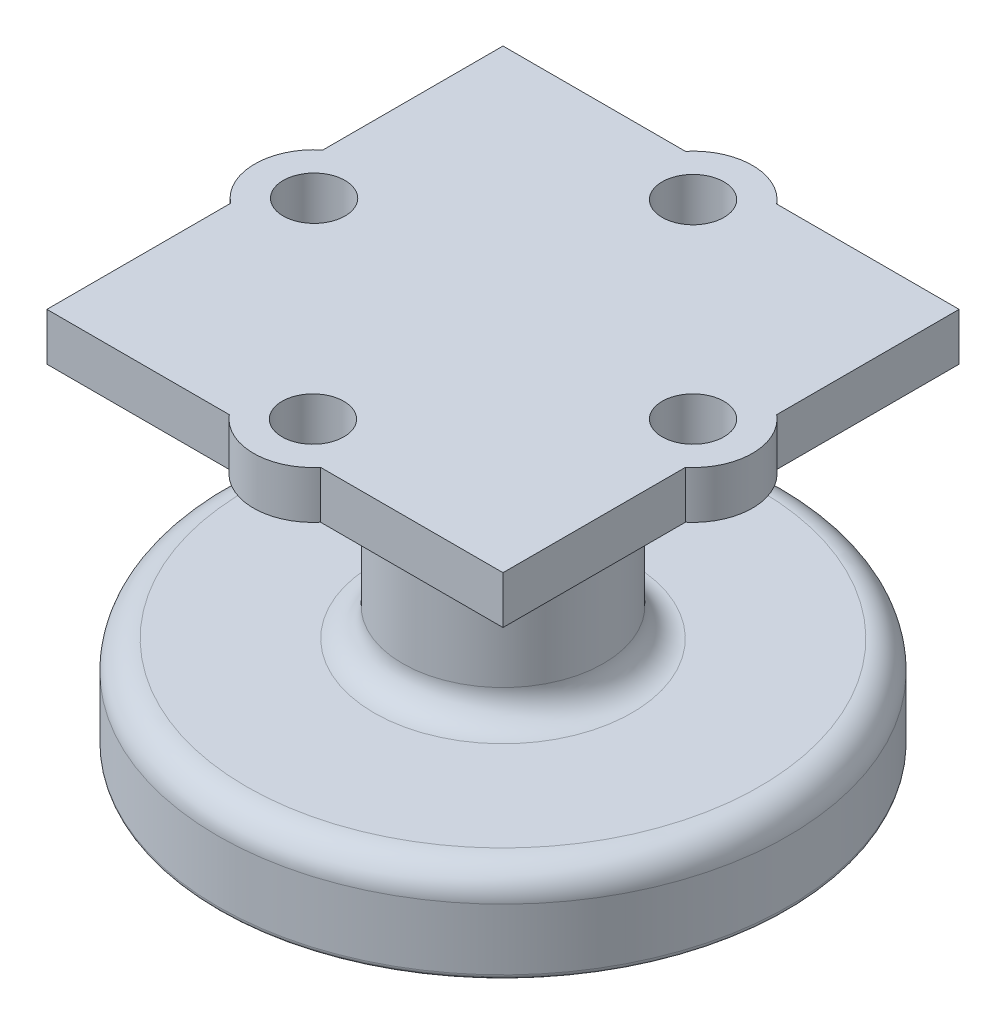
from build123d import *

# Parameters (mm, degrees)
SKETCH1_R           = 3.25
BOSS_EXTRUDE1_DEPTH = 5
SKETCH2_W           = 32.64938716
SKETCH2_H           = 32.90693226
BOSS_EXTRUDE2_DEPTH = 5
SKETCH3_R           = 10.567193536
BOSS_EXTRUDE3_DEPTH = 25
SKETCH4_R           = 30
BOSS_EXTRUDE4_DEPTH = 10
FILLET1_R           = 3
FILLET2_R           = 0.56
FILLET3_R           = 3


with BuildPart() as part:
    # Sketch1 → Boss-Extrude1 (new body)
    with BuildSketch(Plane(origin=(0, 0, 0), x_dir=(1, 0, 0), z_dir=(0, 1, 0))):
        with BuildLine():
            Line((-24, -4.668943148), (-24, -24))
            Line((-24, -24), (-4.802343178, -24))
            ThreePointArc((-4.802343178, -24), (0, -26.25), (4.802343178, -24))
            Line((4.802343178, -24), (24, -24))
            Line((24, -24), (24, -4.802343178))
            ThreePointArc((24, -4.802343178), (26.25, 0), (24, 4.802343178))
            Line((24, 4.802343178), (24, 24))
            Line((24, 24), (4.802343178, 24))
            ThreePointArc((4.802343178, 24), (0, 26.25), (-4.802343178, 24))
            Line((-4.802343178, 24), (-24, 24))
            Line((-24, 24), (-24, 5.04363247))
            ThreePointArc((-24, 5.04363247), (-26.315667945, 0.187344661), (-24, -4.668943148))
        make_face()
        with Locations(Location((-20.065667945, 0.187344661, 0), (0, 0, 270))):
            Circle(SKETCH1_R, mode=Mode.SUBTRACT)
        with Locations(Location((0, 20, 0), (0, 0, 270))):
            Circle(SKETCH1_R, mode=Mode.SUBTRACT)
        with Locations(Location((20, 0, 0), (0, 0, 270))):
            Circle(SKETCH1_R, mode=Mode.SUBTRACT)
        with Locations(Location((0, -20, 0), (0, 0, 270))):
            Circle(SKETCH1_R, mode=Mode.SUBTRACT)
        with BuildLine():
            Line((-16, 16), (-4.802343178, 16))
            ThreePointArc((-4.802343178, 16), (0, 13.75), (4.802343178, 16))
            Line((4.802343178, 16), (16, 16))
            Line((16, 16), (16, 4.802343178))
            ThreePointArc((16, 4.802343178), (13.75, 0), (16, -4.802343178))
            Line((16, -4.802343178), (16, -16))
            Line((16, -16), (4.802343178, -16))
            ThreePointArc((4.802343178, -16), (0, -13.75), (-4.802343178, -16))
            Line((-4.802343178, -16), (-16, -16))
            Line((-16, -16), (-16, -4.559532645))
            ThreePointArc((-16, -4.559532645), (-13.815667945, 0.187344661), (-16, 4.934221967))
            Line((-16, 4.934221967), (-16, 16))
        make_face(mode=Mode.SUBTRACT)
    extrude(amount=BOSS_EXTRUDE1_DEPTH)

    # Sketch2 → Boss-Extrude2 (add)
    with BuildSketch(Plane.XZ):
        Rectangle(SKETCH2_W, SKETCH2_H)
    extrude(amount=-BOSS_EXTRUDE2_DEPTH)

    # Sketch3 → Boss-Extrude3 (add)
    with BuildSketch(Plane(origin=(0, 0, 0), x_dir=(-1, 0, 0), z_dir=(0, -1, 0))):
        with Locations(Location((0, 0, 0), (0, 0, 270))):
            Circle(SKETCH3_R)
    extrude(amount=BOSS_EXTRUDE3_DEPTH)

    # Sketch4 → Boss-Extrude4 (add)
    with BuildSketch(Plane(origin=(0, -25, 0), x_dir=(-1, 0, 0), z_dir=(0, -1, 0))):
        with Locations(Location((0, 0, 0), (0, 0, 90))):
            Circle(SKETCH4_R)
    extrude(amount=BOSS_EXTRUDE4_DEPTH)

    # Fillet1
    fillet1_edges = [part.edges().sort_by_distance(p)[0] for p in [
        (0, 0, -10.567193536),
    ]]
    fillet(fillet1_edges, radius=FILLET1_R)

    # Fillet2
    fillet2_edges = [part.edges().sort_by_distance(p)[0] for p in [
        (0, -35, 30),
    ]]
    fillet(fillet2_edges, radius=FILLET2_R)

    # Fillet3
    fillet3_edges = [part.edges().sort_by_distance(p)[0] for p in [
        (0, -25, -10.567193536),
        (0, -25, 30),
    ]]
    fillet(fillet3_edges, radius=FILLET3_R)


solid = part.part
